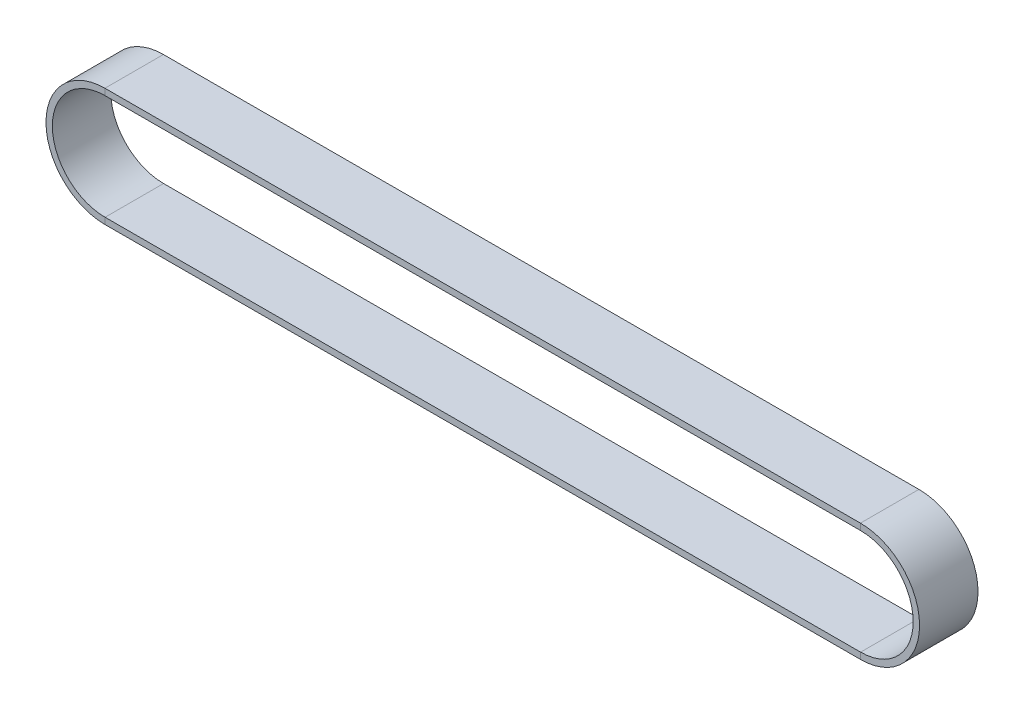
from build123d import *

# Parameters (mm, degrees)
SKETCH4_W = 10.28192
SKETCH4_H = 1.12


with BuildPart() as part:
    # Sweep1: sweep along a path in Sketch1
    with BuildLine(Plane.XY) as sweep1_path:
        Line((-2.41e-07, 9.261094), (132.90351643, 9.461083519))
        ThreePointArc((132.90351643, 9.461083519), (142.178535768, 0.213935094), (132.931386612, -9.061083513))
        Line((132.931386612, -9.061083513), (0.027869908, -9.261052065))
        ThreePointArc((0.027869908, -9.261052065), (-9.247137468, -0.013914106), (-2.41e-07, 9.261094))
    # Sketch4 → Sweep1 (sweep)
    with BuildSketch(Plane.ZY):
        with Locations((5.14096, 9.821094)):
            Rectangle(SKETCH4_W, SKETCH4_H)
    sweep(path=sweep1_path.line)


solid = part.part
